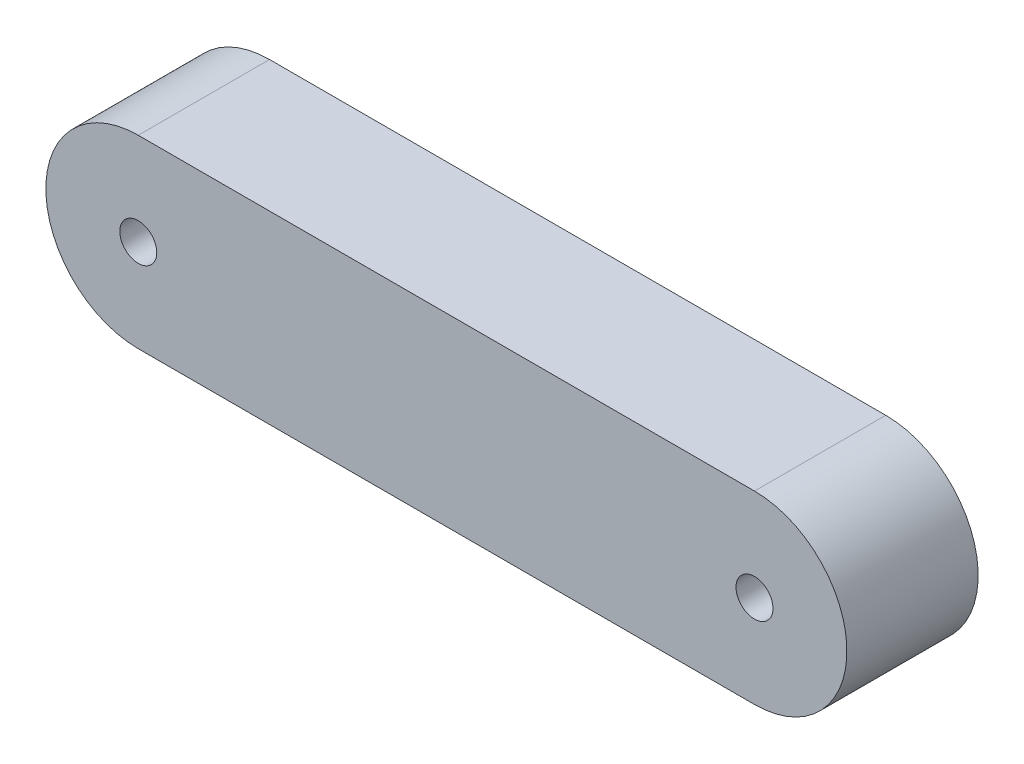
from build123d import *

# Parameters (mm, degrees)
SKETCH1_R           = 6
BOSS_EXTRUDE1_DEPTH = 42.6


with BuildPart() as part:
    # Sketch1 → Boss-Extrude1 (new body)
    with BuildSketch(Plane.XY):
        with BuildLine():
            Line((-100, 30), (100, 30))
            ThreePointArc((100, 30), (130, 0), (100, -30))
            Line((100, -30), (-100, -30))
            ThreePointArc((-100, -30), (-130, 0), (-100, 30))
        make_face()
        with Locations((-100, 0)):
            Circle(SKETCH1_R, mode=Mode.SUBTRACT)
        with Locations((100, 0)):
            Circle(SKETCH1_R, mode=Mode.SUBTRACT)
    extrude(amount=BOSS_EXTRUDE1_DEPTH)


solid = part.part
